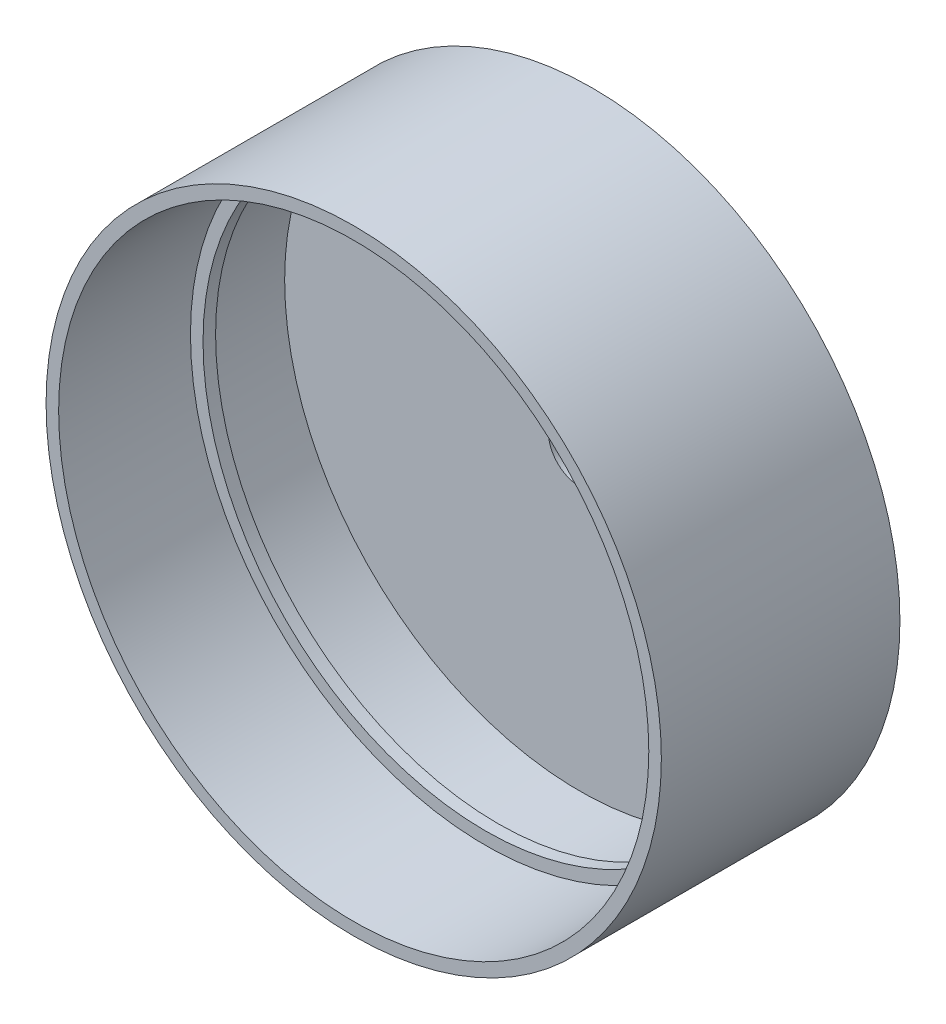
from build123d import *

# Parameters (mm, degrees)
CROQUIS1_R              = 49
CROQUIS1_R_2            = 47
SALIENTE_EXTRUIR1_DEPTH = 38
CROQUIS2_R              = 49
CROQUIS2_R_2            = 5
SALIENTE_EXTRUIR3_DEPTH = 2
SALIENTE_EXTRUIR4_START = 15
CROQUIS3_R              = 49
CROQUIS3_R_2            = 45
SALIENTE_EXTRUIR4_DEPTH = 2


with BuildPart() as part:
    # Croquis1 → Saliente-Extruir1 (new body)
    with BuildSketch(Plane.XY):
        Circle(CROQUIS1_R)
        Circle(CROQUIS1_R_2, mode=Mode.SUBTRACT)
    extrude(amount=SALIENTE_EXTRUIR1_DEPTH)

    # Croquis2 → Saliente-Extruir3 (add)
    with BuildSketch(Plane.XY):
        Circle(CROQUIS2_R)
        Circle(CROQUIS2_R_2, mode=Mode.SUBTRACT)
    extrude(amount=SALIENTE_EXTRUIR3_DEPTH)

    # Croquis3 → Saliente-Extruir4 (add)
    with BuildSketch(Plane.XY.offset(SALIENTE_EXTRUIR4_START)):
        Circle(CROQUIS3_R)
        Circle(CROQUIS3_R_2, mode=Mode.SUBTRACT)
    extrude(amount=SALIENTE_EXTRUIR4_DEPTH)


solid = part.part
